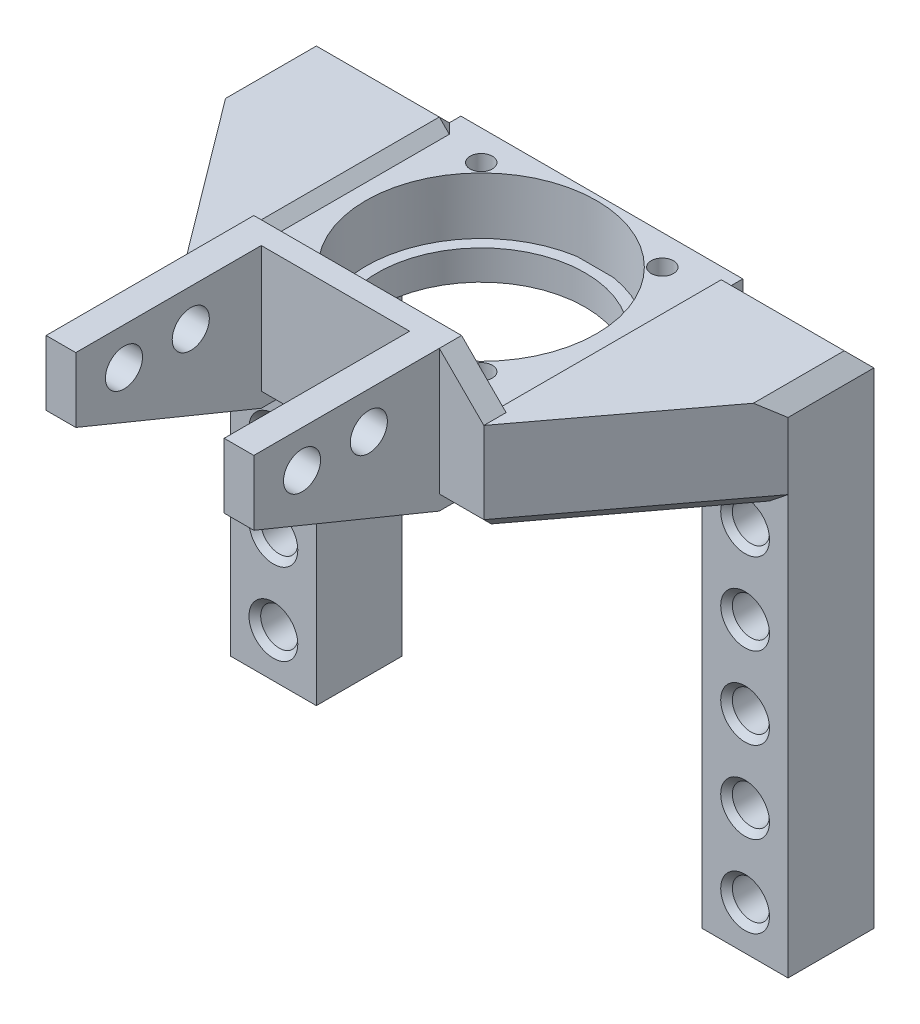
from build123d import *

# Parameters (mm, degrees)
SKETCH1_W                      = 14.7
SKETCH1_H                      = 14.7
BOSS_EXTRUDE1_DEPTH            = 87.63
BOSS_EXTRUDE1_2_DEPTH          = 87.63
SKETCH2_W                      = 95.44
SKETCH2_H                      = 44.45
BOSS_EXTRUDE2_DEPTH            = 2.54
CHAMFER2_SIZE                  = 2
SKETCH12_W                     = 50.8
SKETCH12_H                     = 44.45
BOSS_EXTRUDE5_DEPTH            = 13.97
SKETCH3_R                      = 17.78
SKETCH3_R_2                    = 1.6
CUT_EXTRUDE1_DEPTH             = 107.454804025
BOSS_EXTRUDE3_DEPTH            = 5.08
BOSS_EXTRUDE3_DEPTH_BACK       = 10.16
SKETCH4_W                      = 50.8
SKETCH4_H                      = 3.81
SKETCH5_W                      = 5.08
SKETCH5_H                      = 24.13
BOSS_EXTRUDE4_DEPTH            = 31.75
SKETCH6_R                      = 3.175
TRAYSUPPORTMOUNTINGHOLES_DEPTH = 135.547891102
SKETCH11_R                     = 3.175
CUT_EXTRUDE5_DEPTH             = 124.012238822
CHAMFER4_SIZE                  = 1
CUT_EXTRUDE6_START             = -11.43
SKETCH13_W                     = 43.18
SKETCH13_H                     = 40.64
CUT_EXTRUDE6_DEPTH             = 11.43
SKETCH15_W                     = 22.32
SKETCH15_H                     = 44.45
BOSS_EXTRUDE6_DEPTH            = 13.97
CUT_EXTRUDE7_DEPTH             = 135.547891102
CUT_EXTRUDE8_DEPTH             = 122.229277817
CUT_EXTRUDE9_DEPTH             = 115.023552392
CHAMFER5_SIZE                  = 2.54
CHAMFER6_SIZE                  = 2.54
SKETCH22_W                     = 48.26
SKETCH22_H                     = 41.79
SKETCH22_R                     = 1.905
SKETCH22_R_2                   = 19.75
BOSS_EXTRUDE7_DEPTH            = 14.8


with BuildPart() as part:
    # Sketch1 → Boss-Extrude1 (new body)
    with BuildSketch(Plane(origin=(0, 0, 0), x_dir=(1, 0, 0), z_dir=(0, 1, 0))):
        with Locations((40.37, 0)):
            Rectangle(SKETCH1_W, SKETCH1_H)
    extrude(amount=BOSS_EXTRUDE1_DEPTH)



with BuildPart() as body_2:
    # Sketch1 → Boss-Extrude1 2 (new body)
    with BuildSketch(Plane(origin=(0, 0, 0), x_dir=(1, 0, 0), z_dir=(0, 1, 0))):
        with Locations((-40.37, 0)):
            Rectangle(SKETCH1_W, SKETCH1_H)
    extrude(amount=BOSS_EXTRUDE1_2_DEPTH)


with BuildPart() as part_1:
    add(part.part)

    add(body_2.part)  # Boss-Extrude2 merges body 2
    # Sketch2 → Boss-Extrude2 (add)
    with BuildSketch(Plane(origin=(0, 87.63, 0), x_dir=(1, 0, 0), z_dir=(0, 1, 0))):
        with Locations((0, -14.875)):
            Rectangle(SKETCH2_W, SKETCH2_H)
    extrude(amount=-BOSS_EXTRUDE2_DEPTH)

    # Chamfer2
    chamfer2_edges = [part_1.edges().sort_by_distance(p)[0] for p in [
        (-47.72, 0, 0),
        (-33.02, 0, 0),
        (-40.37, 0, 7.35),
        (-40.37, 0, -7.35),
        (40.37, 0, -7.35),
        (47.72, 0, 0),
        (40.37, 0, 7.35),
        (33.02, 0, 0),
    ]]
    chamfer(chamfer2_edges, length=CHAMFER2_SIZE)

    # Sketch12 → Boss-Extrude5 (add)
    with BuildSketch(Plane.XZ.offset(-85.09)):
        with Locations((0, 14.875)):
            Rectangle(SKETCH12_W, SKETCH12_H)
    extrude(amount=BOSS_EXTRUDE5_DEPTH)

    # Sketch3 → Cut-Extrude1 (cut, through all)
    with BuildSketch(Plane(origin=(0, 87.63, 0), x_dir=(1, 0, 0), z_dir=(0, 1, 0))):
        with Locations(Location((0, -12.15, 0), (0, 0, 270))):
            Circle(SKETCH3_R)
        with Locations(Location((-15.5, 3.35, 0), (0, 0, 270))):
            Circle(SKETCH3_R_2)
        with Locations(Location((-15.5, -27.65, 0), (0, 0, 270))):
            Circle(SKETCH3_R_2)
        with Locations(Location((15.5, -27.65, 0), (0, 0, 270))):
            Circle(SKETCH3_R_2)
        with Locations(Location((15.5, 3.35, 0), (0, 0, 270))):
            Circle(SKETCH3_R_2)
    extrude(amount=-CUT_EXTRUDE1_DEPTH, mode=Mode.SUBTRACT)

    # Sketch4 → Boss-Extrude3 (add, two sides: drawn at the far end of the back side and taken through both)
    with BuildSketch(Plane.XZ.offset(-85.09).offset(-BOSS_EXTRUDE3_DEPTH_BACK)):
        with Locations((0, 35.195)):
            Rectangle(SKETCH4_W, SKETCH4_H)
    extrude(amount=BOSS_EXTRUDE3_DEPTH + BOSS_EXTRUDE3_DEPTH_BACK)

    # Sketch5 → Boss-Extrude4 (add)
    with BuildSketch(Plane.XY.offset(37.1)):
        with Locations((-15.24, 83.185)):
            Rectangle(SKETCH5_W, SKETCH5_H)
        with Locations((15.24, 83.185)):
            Rectangle(SKETCH5_W, SKETCH5_H)
    extrude(amount=BOSS_EXTRUDE4_DEPTH)

    # Sketch6 → TraySupportMountingHoles (cut, through all)
    with BuildSketch(Plane.ZY.offset(17.78)):
        with Locations(Location((49.165, 88.9, 0), (0, 0, 270))):
            Circle(SKETCH6_R)
        with Locations(Location((60.595, 88.9, 0), (0, 0, 270))):
            Circle(SKETCH6_R)
    extrude(amount=-TRAYSUPPORTMOUNTINGHOLES_DEPTH, mode=Mode.SUBTRACT)

    # Sketch11 → Cut-Extrude5 (cut, through all)
    with BuildSketch(Plane.XY.offset(7.35)):
        with Locations((-40.37, 65.405)):
            Circle(SKETCH11_R)
        with Locations((-40.37, 51.435)):
            Circle(SKETCH11_R)
        with Locations((-40.37, 37.465)):
            Circle(SKETCH11_R)
        with Locations((-40.37, 23.495)):
            Circle(SKETCH11_R)
        with Locations((-40.37, 9.525)):
            Circle(SKETCH11_R)
    cut_extrude5 = extrude(amount=-CUT_EXTRUDE5_DEPTH, mode=Mode.SUBTRACT)

    # Mirror1: Cut-Extrude5 across plane
    add(cut_extrude5.mirror(Plane(origin=(0, 0, 0), x_dir=(0, 0, 1), z_dir=(1, 0, 0))), mode=Mode.SUBTRACT)

    # Chamfer4
    chamfer4_edges = [part_1.edges().sort_by_distance(p)[0] for p in [
        (-43.545, 65.405, -7.35),
        (-43.545, 65.405, 7.35),
        (-43.545, 23.495, -7.35),
        (-43.545, 23.495, 7.35),
        (-43.545, 37.465, -7.35),
        (-43.545, 37.465, 7.35),
        (-43.545, 51.435, -7.35),
        (-43.545, 51.435, 7.35),
        (-43.545, 9.525, -7.35),
        (-43.545, 9.525, 7.35),
        (43.545, 65.405, 7.35),
        (43.545, 65.405, -7.35),
        (43.545, 23.495, 7.35),
        (43.545, 23.495, -7.35),
        (43.545, 37.465, 7.35),
        (43.545, 37.465, -7.35),
        (43.545, 51.435, 7.35),
        (43.545, 51.435, -7.35),
        (43.545, 9.525, 7.35),
        (43.545, 9.525, -7.35),
    ]]
    chamfer(chamfer4_edges, length=CHAMFER4_SIZE)

    # Sketch13 → Cut-Extrude6 (cut)
    with BuildSketch(Plane(origin=(0, 87.63, 0), x_dir=(1, 0, 0), z_dir=(0, 1, 0)).offset(CUT_EXTRUDE6_START)):
        with Locations((0, -12.97)):
            Rectangle(SKETCH13_W, SKETCH13_H)
    extrude(amount=CUT_EXTRUDE6_DEPTH, mode=Mode.SUBTRACT)

    # Sketch15 → Boss-Extrude6 (add)
    with BuildSketch(Plane.XZ.offset(-85.09)):
        with Locations((36.56, 14.875)):
            Rectangle(SKETCH15_W, SKETCH15_H)
        with Locations((-36.56, 14.875)):
            Rectangle(SKETCH15_W, SKETCH15_H)
    extrude(amount=BOSS_EXTRUDE6_DEPTH)

    # Sketch17 → Cut-Extrude7 (cut, through all)
    with BuildSketch(Plane.ZY.offset(17.78)):
        Polygon((37.1, 71.12), (68.85, 84.148095119), (68.85, 71.12), align=None)
    extrude(amount=-CUT_EXTRUDE7_DEPTH, mode=Mode.SUBTRACT)

    # Sketch20 → Cut-Extrude8 (cut, through all)
    with BuildSketch(Plane(origin=(0, 87.63, 0), x_dir=(-1, 0, 0), z_dir=(0, -1, 0))):
        Polygon((-25.4, -37.1), (-47.72, -7.35), (-47.72, -37.1), align=None)
        Polygon((47.72, -7.35), (25.4, -37.1), (47.72, -37.1), align=None)
    extrude(amount=CUT_EXTRUDE8_DEPTH, mode=Mode.SUBTRACT)

    # Sketch21 → Cut-Extrude9 (cut, through all)
    with BuildSketch(Plane(origin=(0, 0, 33.29), x_dir=(-1, 0, 0), z_dir=(0, 0, -1))):
        Polygon((-25.4, 87.63), (-17.78, 95.25), (-25.4, 95.25), align=None)
        Polygon((25.4, 87.63), (17.78, 95.25), (25.4, 95.25), align=None)
    extrude(amount=-CUT_EXTRUDE9_DEPTH, mode=Mode.SUBTRACT)

    # Chamfer5
    chamfer5_edges = [part_1.edges().sort_by_distance(p)[0] for p in [
        (0, 71.12, 37.1),
        (-21.59, 71.12, 37.1),
        (34.655, 87.63, -7.35),
        (-47.72, 87.63, 0),
        (-34.655, 87.63, -7.35),
        (-21.59, 87.63, 12.97),
        (21.59, 87.63, 12.97),
        (-21.59, 81.915, -7.35),
        (21.59, 81.915, -7.35),
        (21.59, 71.12, 37.1),
        (47.72, 87.63, 0),
    ]]
    chamfer(chamfer5_edges, length=CHAMFER5_SIZE)

    # Chamfer6
    chamfer6_edges = [part_1.edges().sort_by_distance(p)[0] for p in [
        (37.512820168, 71.12, 20.955),
        (-37.512820168, 71.12, 20.955),
    ]]
    chamfer(chamfer6_edges, length=CHAMFER6_SIZE)

    # Sketch22 → Boss-Extrude7 (add)
    with BuildSketch(Plane(origin=(0, 85.92, 0), x_dir=(1, 0, 0), z_dir=(0, 1, 0))):
        with Locations((0, -12.395)):
            Rectangle(SKETCH22_W, SKETCH22_H)
        with Locations(Location((-15.5, 3.35, 0), (0, 0, 270))):
            Circle(SKETCH22_R, mode=Mode.SUBTRACT)
        with Locations(Location((15.5, 3.35, 0), (0, 0, 270))):
            Circle(SKETCH22_R, mode=Mode.SUBTRACT)
        with Locations(Location((15.5, -27.65, 0), (0, 0, 270))):
            Circle(SKETCH22_R, mode=Mode.SUBTRACT)
        with Locations(Location((-15.5, -27.65, 0), (0, 0, 270))):
            Circle(SKETCH22_R, mode=Mode.SUBTRACT)
        with Locations(Location((0, -12.15, 0), (0, 0, 270))):
            Circle(SKETCH22_R_2, mode=Mode.SUBTRACT)
    extrude(amount=-BOSS_EXTRUDE7_DEPTH)


solid = part_1.part
